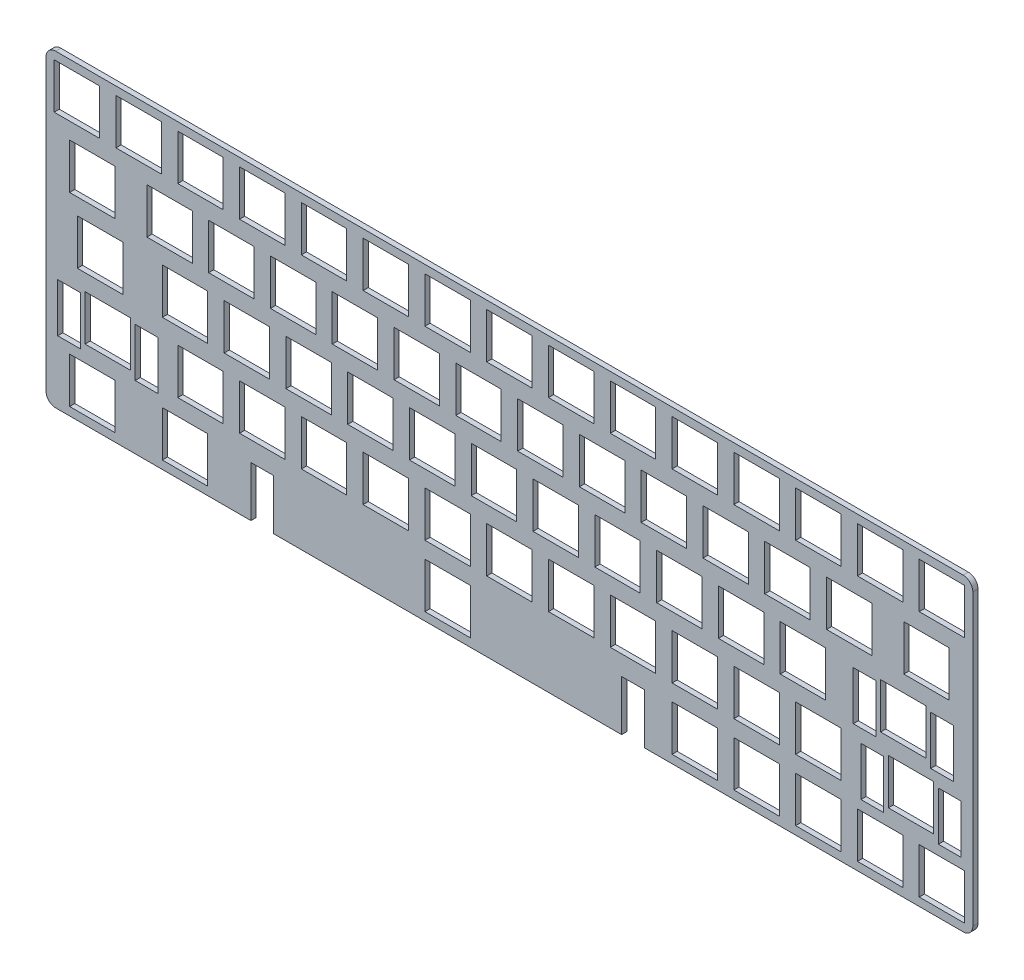
from build123d import *

# Parameters (mm, degrees)
MODEL_W             = 14
MODEL_H             = 14
MODEL_W_2           = 7
MODEL_H_2           = 15
BOSS_EXTRUDE1_DEPTH = 1.6


with BuildPart() as part:
    # Model → Boss-Extrude1 (new body)
    with BuildSketch(Plane.XY):
        with BuildLine():
            Line((177.475, -79.725), (184.475, -79.725))
            Line((184.475, -79.725), (184.475, -94.725))
            Line((184.475, -94.725), (184.475, -95.25))
            Line((184.475, -95.25), (282.75, -95.25))
            ThreePointArc((282.75, -95.25), (284.871320344, -94.371320344), (285.75, -92.25))
            Line((285.75, -92.25), (285.75, -3))
            ThreePointArc((285.75, -3), (284.871320344, -0.878679656), (282.75, 0))
            Line((282.75, 0), (3, 0))
            ThreePointArc((3, 0), (0.878679656, -0.878679656), (0, -3))
            Line((0, -3), (0, -92.25))
            ThreePointArc((0, -92.25), (0.878679656, -94.371320344), (3, -95.25))
            Line((3, -95.25), (63.175, -95.25))
            Line((63.175, -95.25), (63.175, -94.725))
            Line((63.175, -94.725), (63.175, -79.725))
            Line((63.175, -79.725), (70.175, -79.725))
            Line((70.175, -79.725), (70.175, -94.725))
            Line((70.175, -94.725), (70.175, -95.25))
            Line((70.175, -95.25), (177.475, -95.25))
            Line((177.475, -95.25), (177.475, -94.725))
            Line((177.475, -94.725), (177.475, -79.725))
        make_face()
        with Locations((9.525, -9.525)):
            Rectangle(MODEL_W, MODEL_H, mode=Mode.SUBTRACT)
        with Locations((28.575, -9.525)):
            Rectangle(MODEL_W, MODEL_H, mode=Mode.SUBTRACT)
        with Locations((47.625, -9.525)):
            Rectangle(MODEL_W, MODEL_H, mode=Mode.SUBTRACT)
        with Locations((66.675, -9.525)):
            Rectangle(MODEL_W, MODEL_H, mode=Mode.SUBTRACT)
        with Locations((85.725, -9.525)):
            Rectangle(MODEL_W, MODEL_H, mode=Mode.SUBTRACT)
        with Locations((104.775, -9.525)):
            Rectangle(MODEL_W, MODEL_H, mode=Mode.SUBTRACT)
        with Locations((123.825, -9.525)):
            Rectangle(MODEL_W, MODEL_H, mode=Mode.SUBTRACT)
        with Locations((142.875, -9.525)):
            Rectangle(MODEL_W, MODEL_H, mode=Mode.SUBTRACT)
        with Locations((161.925, -9.525)):
            Rectangle(MODEL_W, MODEL_H, mode=Mode.SUBTRACT)
        with Locations((180.975, -9.525)):
            Rectangle(MODEL_W, MODEL_H, mode=Mode.SUBTRACT)
        with Locations((200.025, -9.525)):
            Rectangle(MODEL_W, MODEL_H, mode=Mode.SUBTRACT)
        with Locations((219.075, -9.525)):
            Rectangle(MODEL_W, MODEL_H, mode=Mode.SUBTRACT)
        with Locations((238.125, -9.525)):
            Rectangle(MODEL_W, MODEL_H, mode=Mode.SUBTRACT)
        with Locations((257.175, -9.525)):
            Rectangle(MODEL_W, MODEL_H, mode=Mode.SUBTRACT)
        with Locations((276.225, -9.525)):
            Rectangle(MODEL_W, MODEL_H, mode=Mode.SUBTRACT)
        with Locations((14.2875, -28.575)):
            Rectangle(MODEL_W, MODEL_H, mode=Mode.SUBTRACT)
        with Locations((38.1, -28.575)):
            Rectangle(MODEL_W, MODEL_H, mode=Mode.SUBTRACT)
        with Locations((57.15, -28.575)):
            Rectangle(MODEL_W, MODEL_H, mode=Mode.SUBTRACT)
        with Locations((76.2, -28.575)):
            Rectangle(MODEL_W, MODEL_H, mode=Mode.SUBTRACT)
        with Locations((95.25, -28.575)):
            Rectangle(MODEL_W, MODEL_H, mode=Mode.SUBTRACT)
        with Locations((114.3, -28.575)):
            Rectangle(MODEL_W, MODEL_H, mode=Mode.SUBTRACT)
        with Locations((133.35, -28.575)):
            Rectangle(MODEL_W, MODEL_H, mode=Mode.SUBTRACT)
        with Locations((152.4, -28.575)):
            Rectangle(MODEL_W, MODEL_H, mode=Mode.SUBTRACT)
        with Locations((171.45, -28.575)):
            Rectangle(MODEL_W, MODEL_H, mode=Mode.SUBTRACT)
        with Locations((190.5, -28.575)):
            Rectangle(MODEL_W, MODEL_H, mode=Mode.SUBTRACT)
        with Locations((209.55, -28.575)):
            Rectangle(MODEL_W, MODEL_H, mode=Mode.SUBTRACT)
        with Locations((228.6, -28.575)):
            Rectangle(MODEL_W, MODEL_H, mode=Mode.SUBTRACT)
        with Locations((247.65, -28.575)):
            Rectangle(MODEL_W, MODEL_H, mode=Mode.SUBTRACT)
        with Locations((271.4625, -28.575)):
            Rectangle(MODEL_W, MODEL_H, mode=Mode.SUBTRACT)
        with Locations((16.66875, -47.625)):
            Rectangle(MODEL_W, MODEL_H, mode=Mode.SUBTRACT)
        with Locations((42.8625, -47.625)):
            Rectangle(MODEL_W, MODEL_H, mode=Mode.SUBTRACT)
        with Locations((61.9125, -47.625)):
            Rectangle(MODEL_W, MODEL_H, mode=Mode.SUBTRACT)
        with Locations((80.9625, -47.625)):
            Rectangle(MODEL_W, MODEL_H, mode=Mode.SUBTRACT)
        with Locations((100.0125, -47.625)):
            Rectangle(MODEL_W, MODEL_H, mode=Mode.SUBTRACT)
        with Locations((119.0625, -47.625)):
            Rectangle(MODEL_W, MODEL_H, mode=Mode.SUBTRACT)
        with Locations((138.1125, -47.625)):
            Rectangle(MODEL_W, MODEL_H, mode=Mode.SUBTRACT)
        with Locations((157.1625, -47.625)):
            Rectangle(MODEL_W, MODEL_H, mode=Mode.SUBTRACT)
        with Locations((176.2125, -47.625)):
            Rectangle(MODEL_W, MODEL_H, mode=Mode.SUBTRACT)
        with Locations((195.2625, -47.625)):
            Rectangle(MODEL_W, MODEL_H, mode=Mode.SUBTRACT)
        with Locations((214.3125, -47.625)):
            Rectangle(MODEL_W, MODEL_H, mode=Mode.SUBTRACT)
        with Locations((233.3625, -47.625)):
            Rectangle(MODEL_W, MODEL_H, mode=Mode.SUBTRACT)
        with Locations((264.31875, -47.625)):
            Rectangle(MODEL_W, MODEL_H, mode=Mode.SUBTRACT)
        with Locations((276.25675, -49.125)):
            Rectangle(MODEL_W_2, MODEL_H_2, mode=Mode.SUBTRACT)
        with Locations((252.38075, -49.125)):
            Rectangle(MODEL_W_2, MODEL_H_2, mode=Mode.SUBTRACT)
        with Locations((19.05, -66.675)):
            Rectangle(MODEL_W, MODEL_H, mode=Mode.SUBTRACT)
        with Locations((30.988, -68.175)):
            Rectangle(MODEL_W_2, MODEL_H_2, mode=Mode.SUBTRACT)
        with Locations((7.112, -68.175)):
            Rectangle(MODEL_W_2, MODEL_H_2, mode=Mode.SUBTRACT)
        with Locations((47.625, -66.675)):
            Rectangle(MODEL_W, MODEL_H, mode=Mode.SUBTRACT)
        with Locations((66.675, -66.675)):
            Rectangle(MODEL_W, MODEL_H, mode=Mode.SUBTRACT)
        with Locations((85.725, -66.675)):
            Rectangle(MODEL_W, MODEL_H, mode=Mode.SUBTRACT)
        with Locations((104.775, -66.675)):
            Rectangle(MODEL_W, MODEL_H, mode=Mode.SUBTRACT)
        with Locations((123.825, -66.675)):
            Rectangle(MODEL_W, MODEL_H, mode=Mode.SUBTRACT)
        with Locations((142.875, -66.675)):
            Rectangle(MODEL_W, MODEL_H, mode=Mode.SUBTRACT)
        with Locations((161.925, -66.675)):
            Rectangle(MODEL_W, MODEL_H, mode=Mode.SUBTRACT)
        with Locations((180.975, -66.675)):
            Rectangle(MODEL_W, MODEL_H, mode=Mode.SUBTRACT)
        with Locations((200.025, -66.675)):
            Rectangle(MODEL_W, MODEL_H, mode=Mode.SUBTRACT)
        with Locations((219.075, -66.675)):
            Rectangle(MODEL_W, MODEL_H, mode=Mode.SUBTRACT)
        with Locations((238.125, -66.675)):
            Rectangle(MODEL_W, MODEL_H, mode=Mode.SUBTRACT)
        with Locations((266.7, -66.675)):
            Rectangle(MODEL_W, MODEL_H, mode=Mode.SUBTRACT)
        with Locations((278.638, -68.175)):
            Rectangle(MODEL_W_2, MODEL_H_2, mode=Mode.SUBTRACT)
        with Locations((254.762, -68.175)):
            Rectangle(MODEL_W_2, MODEL_H_2, mode=Mode.SUBTRACT)
        with Locations((14.2875, -85.725)):
            Rectangle(MODEL_W, MODEL_H, mode=Mode.SUBTRACT)
        with Locations((42.8625, -85.725)):
            Rectangle(MODEL_W, MODEL_H, mode=Mode.SUBTRACT)
        with Locations((123.825, -85.725)):
            Rectangle(MODEL_W, MODEL_H, mode=Mode.SUBTRACT)
        with Locations((200.025, -85.725)):
            Rectangle(MODEL_W, MODEL_H, mode=Mode.SUBTRACT)
        with Locations((219.075, -85.725)):
            Rectangle(MODEL_W, MODEL_H, mode=Mode.SUBTRACT)
        with Locations((238.125, -85.725)):
            Rectangle(MODEL_W, MODEL_H, mode=Mode.SUBTRACT)
        with Locations((257.175, -85.725)):
            Rectangle(MODEL_W, MODEL_H, mode=Mode.SUBTRACT)
        with Locations((276.225, -85.725)):
            Rectangle(MODEL_W, MODEL_H, mode=Mode.SUBTRACT)
    extrude(amount=BOSS_EXTRUDE1_DEPTH)


solid = part.part
